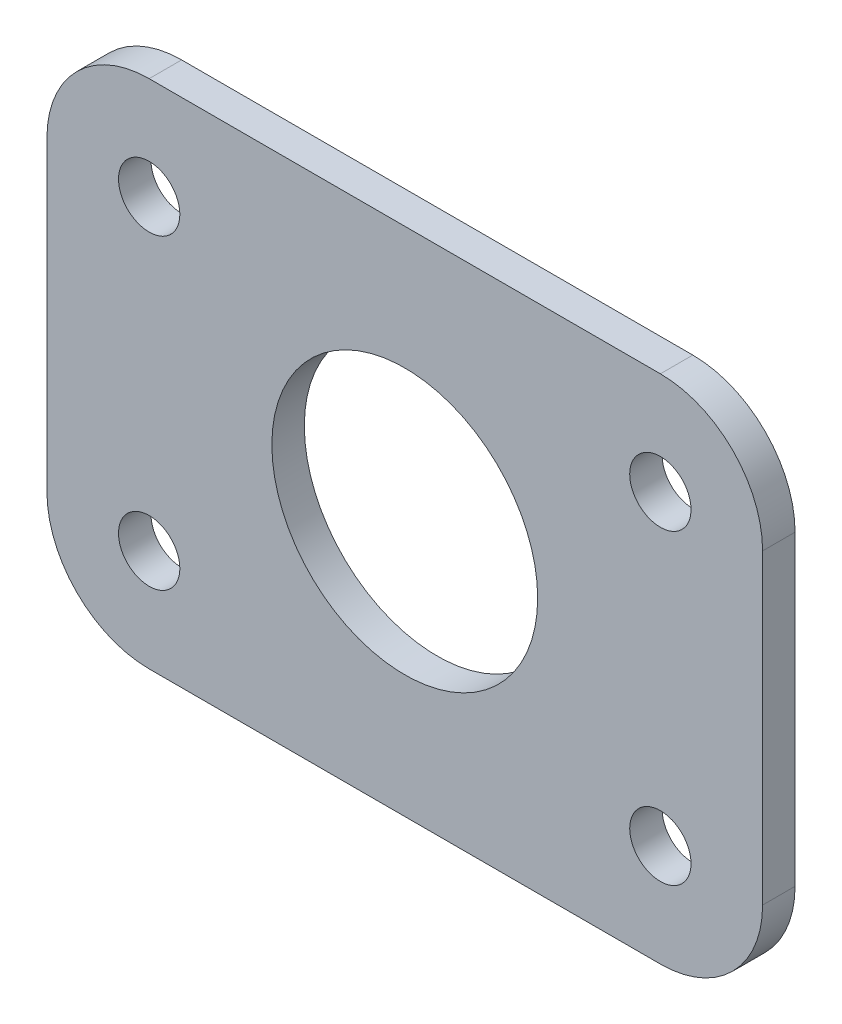
from build123d import *

# Parameters (mm, degrees)
SKETCH1_W           = 35
SKETCH1_H           = 25
SKETCH1_R           = 6.5
SKETCH1_R_2         = 1.5
BOSS_EXTRUDE1_DEPTH = 1.5875
FILLET1_R           = 5


with BuildPart() as part:
    # Sketch1 → Boss-Extrude1 (new body)
    with BuildSketch(Plane.XY):
        with Locations((17.5, 12.5)):
            Rectangle(SKETCH1_W, SKETCH1_H)
        with Locations((17.5, 12.5)):
            Circle(SKETCH1_R, mode=Mode.SUBTRACT)
        with Locations((5, 20)):
            Circle(SKETCH1_R_2, mode=Mode.SUBTRACT)
        with Locations((5, 5)):
            Circle(SKETCH1_R_2, mode=Mode.SUBTRACT)
        with Locations(Location((30, 5, 0), (0, 0, 180))):
            Circle(SKETCH1_R_2, mode=Mode.SUBTRACT)
        with Locations(Location((30, 20, 0), (0, 0, 180))):
            Circle(SKETCH1_R_2, mode=Mode.SUBTRACT)
    extrude(amount=BOSS_EXTRUDE1_DEPTH)

    # Fillet1
    fillet1_edges = [part.edges().sort_by_distance(p)[0] for p in [
        (0, 0, 0.79375),
        (0, 25, 0.79375),
        (35, 25, 0.79375),
        (35, 0, 0.79375),
    ]]
    fillet(fillet1_edges, radius=FILLET1_R)


solid = part.part
